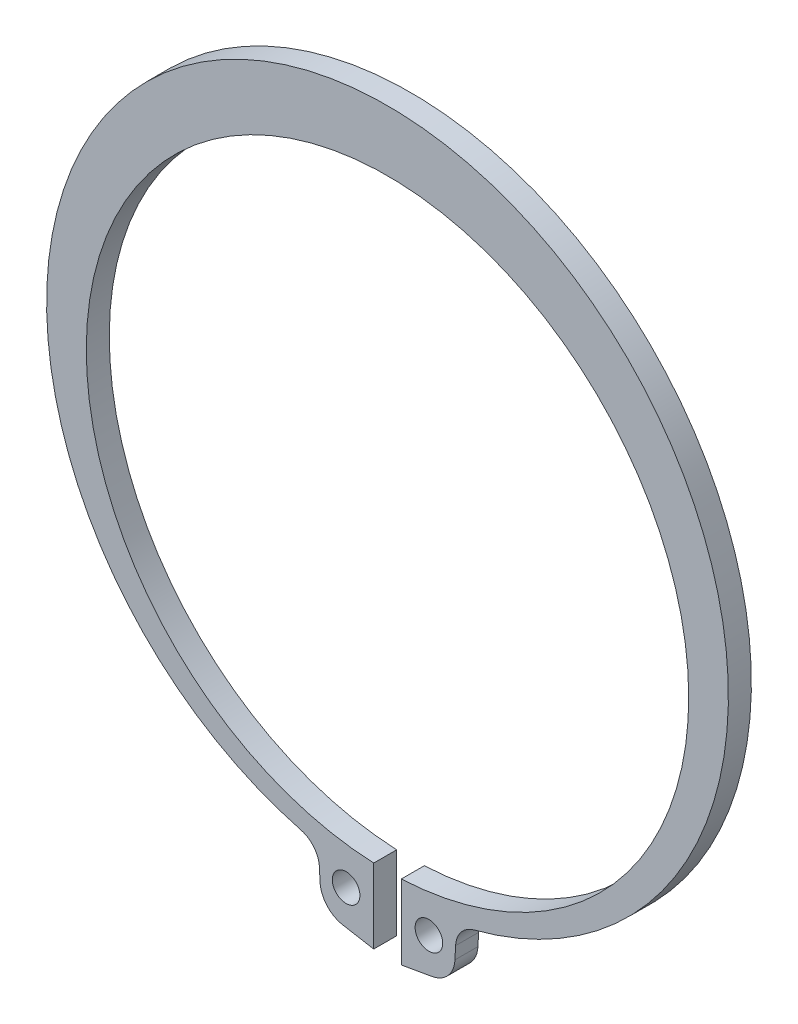
from build123d import *

# Parameters (mm, degrees)
SKETCH_2_R      = 1.5
EXTRUDE_1_DEPTH = 1.25
FILLET_1_R      = 2.7


with BuildPart() as part:
    # 草图2 → 凸台-拉伸1 (new, symmetric)
    with BuildSketch(Plane.XY):
        with BuildLine():
            Line((7.33426448, -37.414752853), (7.5, -34.008214709))
            ThreePointArc((7.5, -34.008214709), (0, 39.35), (-7.5, -34.008214709))
            Line((-7.5, -34.008214709), (-7.33426448, -37.414752853))
            ThreePointArc((-7.33426448, -37.414752853), (-6.588395249, -39.252616986), (-4.858753275, -40.223391997))
            Line((-4.858753275, -40.223391997), (-1.5, -40.815630821))
            Line((-1.5, -40.815630821), (-1.5, -32.715630821))
            ThreePointArc((-1.5, -32.715630821), (0, 32.75), (1.5, -32.715630821))
            Line((1.5, -32.715630821), (1.5, -40.815630821))
            Line((1.5, -40.815630821), (4.858753275, -40.223391997))
            ThreePointArc((4.858753275, -40.223391997), (6.588395249, -39.252616986), (7.33426448, -37.414752853))
        make_face()
        with Locations((4.5, -36.523827839)):
            Circle(SKETCH_2_R, mode=Mode.SUBTRACT)
        with Locations(Location((-4.5, -36.523827839, 0), (0, 0, 180))):
            Circle(SKETCH_2_R, mode=Mode.SUBTRACT)
    extrude(amount=EXTRUDE_1_DEPTH, both=True)

    # 圆角1
    fillet_1_edges = [part.edges().sort_by_distance(p)[0] for p in [
        (-7.5, -34.008214709, 0),
        (7.5, -34.008214709, 0),
    ]]
    fillet(fillet_1_edges, radius=FILLET_1_R)


solid = part.part
